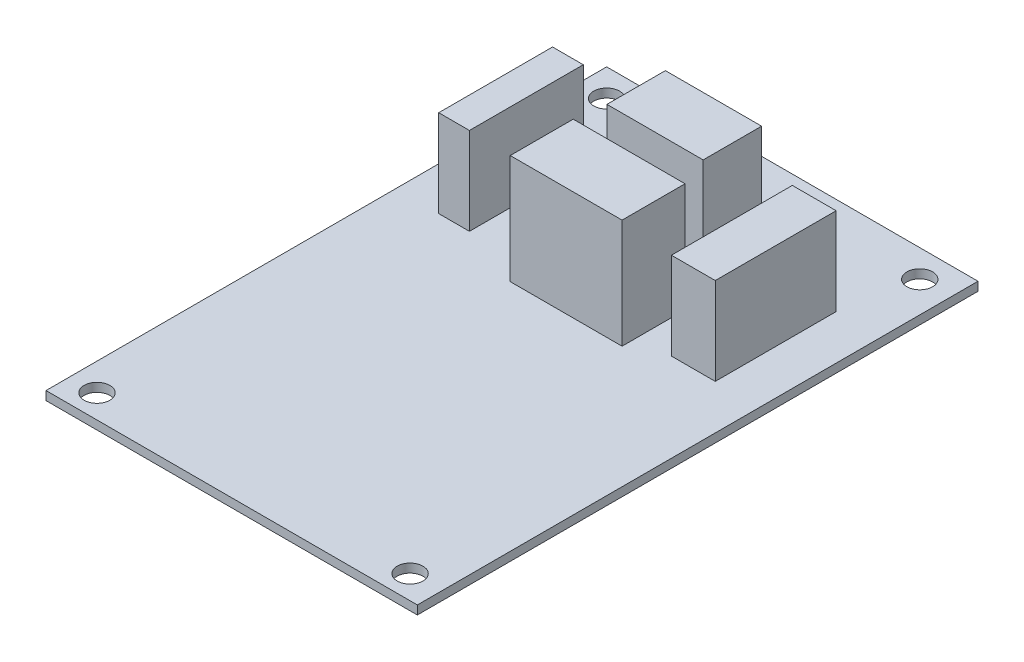
from build123d import *

# Parameters (mm, degrees)
SKETCH1_W           = 51
SKETCH1_H           = 77
BOSS_EXTRUDE1_DEPTH = 1.2
SKETCH2_R           = 1.77
CUT_EXTRUDE1_DEPTH  = 1.2
SKETCH3_W           = 13.21357214
SKETCH3_H           = 8.024996692
SKETCH3_W_2         = 15.358183325
SKETCH3_H_2         = 8.647625746
BOSS_EXTRUDE2_DEPTH = 15
SKETCH4_W           = 4.220041364
SKETCH4_H           = 15.634907348
SKETCH4_W_2         = 6.018747519
SKETCH4_H_2         = 16.603441432
BOSS_EXTRUDE3_DEPTH = 12


with BuildPart() as part:
    # Sketch1 → Boss-Extrude1 (new body)
    with BuildSketch(Plane(origin=(0, 0, 0), x_dir=(1, 0, 0), z_dir=(0, 1, 0))):
        with Locations((25.5, -38.5)):
            Rectangle(SKETCH1_W, SKETCH1_H)
    extrude(amount=BOSS_EXTRUDE1_DEPTH)

    # Sketch2 → Cut-Extrude1 (cut)
    with BuildSketch(Plane(origin=(0, 1.2, 0), x_dir=(1, 0, 0), z_dir=(0, 1, 0))):
        with Locations(Location((3.77, -3.77, 0), (0, 0, 270))):
            Circle(SKETCH2_R)
        with Locations(Location((46.77, -3.77, 0), (0, 0, 270))):
            Circle(SKETCH2_R)
        with Locations(Location((46.77, -73.77, 0), (0, 0, 270))):
            Circle(SKETCH2_R)
        with Locations(Location((3.77, -73.77, 0), (0, 0, 270))):
            Circle(SKETCH2_R)
    extrude(amount=-CUT_EXTRUDE1_DEPTH, mode=Mode.SUBTRACT)

    # Sketch3 → Boss-Extrude2 (add)
    with BuildSketch(Plane(origin=(0, 1.2, 0), x_dir=(1, 0, 0), z_dir=(0, 1, 0))):
        with Locations((26.088038551, -15.42813451)):
            Rectangle(SKETCH3_W, SKETCH3_H)
        with Locations((26.606896096, -27.846125081)):
            Rectangle(SKETCH3_W_2, SKETCH3_H_2)
    extrude(amount=BOSS_EXTRUDE2_DEPTH)

    # Sketch4 → Boss-Extrude3 (add)
    with BuildSketch(Plane(origin=(0, 1.2, 0), x_dir=(1, 0, 0), z_dir=(0, 1, 0))):
        with Locations((8.031795993, -21.170158005)):
            Rectangle(SKETCH4_W, SKETCH4_H)
        with Locations((41.861307912, -21.654425047)):
            Rectangle(SKETCH4_W_2, SKETCH4_H_2)
    extrude(amount=BOSS_EXTRUDE3_DEPTH)


solid = part.part
